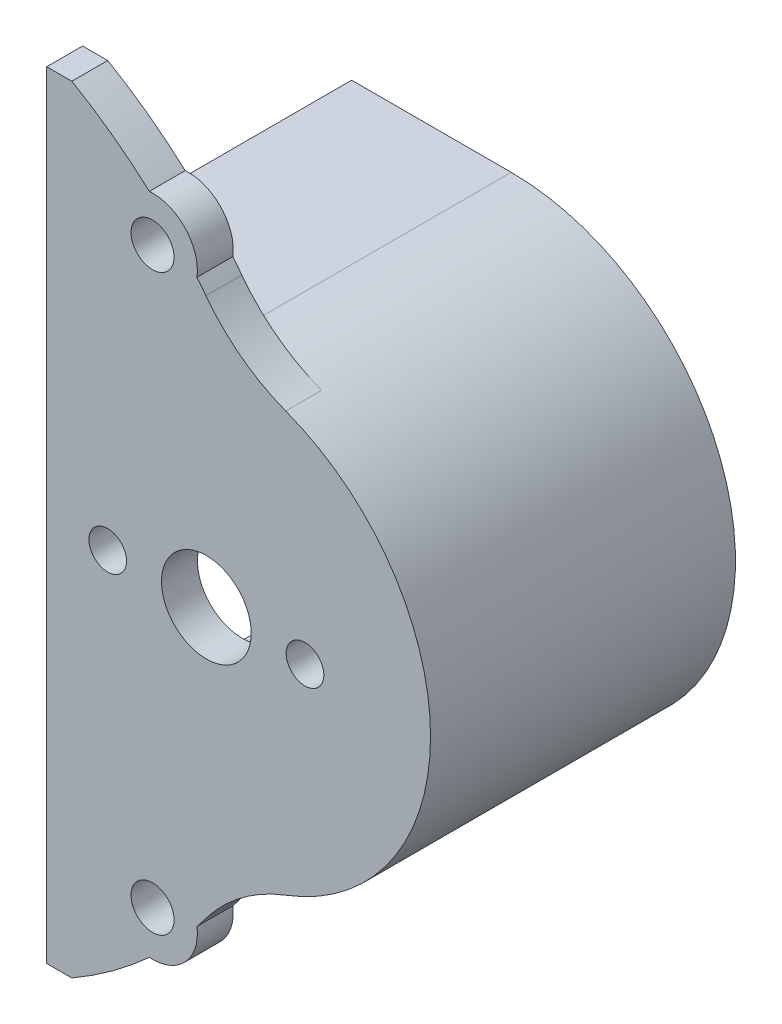
from build123d import *
from build123d.topology import SkipClean

# Parameters (mm, degrees)
EXTRUDE_1_DEPTH     = 2
SKETCH_2_R          = 2.5
SKETCH_2_R_2        = 1.05
CUT_EXTRUDE_1_DEPTH = 5
SKETCH_4_R          = 1.1
CUT_EXTRUDE_2_DEPTH = 2
EXTRUDE_START       = -2
EXTRUDE_2_DEPTH     = 2
SKETCH_6_OUTSIDE_W  = 57.136
SKETCH_6_OUTSIDE_H  = 39.994
SKETCH_6_OUTSIDE_R  = 12.5
CUT_EXTRUDE_3_DEPTH = 10
EXTRUDE_3_DEPTH     = 2
SKETCH_8_R          = 1.2
CUT_EXTRUDE_4_DEPTH = 10
SKETCH_9_OUTSIDE_W  = 38.188
SKETCH_9_OUTSIDE_H  = 63.188
CUT_EXTRUDE_5_DEPTH = 14
CUT_EXTRUDE_6_DEPTH = 10
SKETCH_11_W         = 2
SKETCH_11_H         = 43.30127019
EXTRUDE_4_DEPTH     = 1.4
EXTRUDE_1_2_DEPTH   = 15


with BuildPart() as part:
    # 草图1 → Extrude 1 (new body)
    with BuildSketch(Plane.XY):
        with BuildLine():
            ThreePointArc((21.650635095, 12.5), (0, 25), (-21.650635095, 12.5))
            ThreePointArc((-21.650635095, 12.5), (-19.820508076, 5.669872981), (-12.990381057, 7.5))
            ThreePointArc((-12.990381057, 7.5), (0, 15), (12.990381057, 7.5))
            ThreePointArc((12.990381057, 7.5), (19.820508076, 5.669872981), (21.650635095, 12.5))
        make_face()
    extrude(amount=EXTRUDE_1_DEPTH)

    # 草图2 → 切除-拉伸1 (cut)
    with BuildSketch(Plane.XY.offset(2)):
        with Locations((0, 20)):
            Circle(SKETCH_2_R)
        with Locations((-5.5, 20)):
            Circle(SKETCH_2_R_2)
        with Locations((5.5, 20)):
            Circle(SKETCH_2_R_2)
    extrude(amount=-CUT_EXTRUDE_1_DEPTH, mode=Mode.SUBTRACT)

    # 草图4 → 切除-拉伸2 (cut)
    with BuildSketch(Plane.XY.offset(2)):
        with Locations((-17.320508076, 10)):
            Circle(SKETCH_4_R)
        with Locations((17.320508076, 10)):
            Circle(SKETCH_4_R)
    extrude(amount=-CUT_EXTRUDE_2_DEPTH, mode=Mode.SUBTRACT)

    # 草图5 → 凸台-拉伸2 (add)
    with BuildSketch(Plane.XY.offset(2).offset(EXTRUDE_START)):
        with BuildLine():
            ThreePointArc((-9.363273917, 11.71875), (0, 7.5), (9.363273917, 11.71875))
            ThreePointArc((9.363273917, 11.71875), (0, 15), (-9.363273917, 11.71875))
        make_face()
        with BuildLine():
            ThreePointArc((12.381272085, 21.71875), (0, 25), (-12.381272085, 21.71875))
            ThreePointArc((-12.381272085, 21.71875), (0, 32.5), (12.381272085, 21.71875))
        make_face()
    extrude(amount=EXTRUDE_2_DEPTH)

    # 草图6 outside → 切除-拉伸3 (cut)
    with SkipClean():  # the faces are left unmerged after this step: merging them gives an invalid solid
        with BuildSketch(Plane.XY.offset(2)):
            with Locations((0, 18.75)):
                Rectangle(SKETCH_6_OUTSIDE_W, SKETCH_6_OUTSIDE_H)
            with Locations((0, 20)):
                Circle(SKETCH_6_OUTSIDE_R, mode=Mode.SUBTRACT)
        extrude(amount=-CUT_EXTRUDE_3_DEPTH, mode=Mode.SUBTRACT)

    # 草图7 → 凸台-拉伸3 (add)
    with SkipClean():  # the faces are left unmerged after this step: merging them gives an invalid solid
        with BuildSketch(Plane.XY.offset(2)):
            with BuildLine():
                Line((-7.5, 10), (-7.5, -5))
                Line((-7.5, -5), (7.5, -5))
                Line((7.5, -5), (7.5, 10))
                ThreePointArc((7.5, 10), (0, 7.5), (-7.5, 10))
            make_face()
            with BuildLine():
                Line((-7.5, 45), (7.5, 45))
                Line((7.5, 45), (7.5, 30))
                ThreePointArc((7.5, 30), (0, 32.5), (-7.5, 30))
                Line((-7.5, 30), (-7.5, 45))
            make_face()
        extrude(amount=-EXTRUDE_3_DEPTH)

    # 草图8 → 切除-拉伸4 (cut)
    with SkipClean():  # the faces are left unmerged after this step: merging them gives an invalid solid
        with BuildSketch(Plane.XY.offset(2)):
            with Locations((-3, 4)):
                Circle(SKETCH_8_R)
            with Locations((-3, 36)):
                Circle(SKETCH_8_R)
        extrude(amount=-CUT_EXTRUDE_4_DEPTH, mode=Mode.SUBTRACT)

    # 草图9 outside → 切除-拉伸5 (cut)
    with SkipClean():  # the faces are left unmerged after this step: merging them gives an invalid solid
        with BuildSketch(Plane.XY.offset(2)):
            with Locations((0, 20)):
                Rectangle(SKETCH_9_OUTSIDE_W, SKETCH_9_OUTSIDE_H)
            with BuildLine():
                ThreePointArc((4.427083333, 8.310220996), (12.5, 20), (4.427083333, 31.689779004))
                ThreePointArc((4.427083333, 31.689779004), (1.965433704, 33.044090503), (-0.022321429, 35.029715862))
                ThreePointArc((-0.022321429, 35.029715862), (-0.269391354, 35.352624611), (-0.52168006, 35.671472564))
                ThreePointArc((-0.52168006, 35.671472564), (-1.179500018, 37.713411748), (-3.177861224, 38.493665051))
                ThreePointArc((-3.177861224, 38.493665051), (-45, 20), (-3.177861224, 1.506334949))
                ThreePointArc((-3.177861224, 1.506334949), (-1.179500018, 2.286588252), (-0.52168006, 4.328527436))
                ThreePointArc((-0.52168006, 4.328527436), (-0.269391354, 4.647375389), (-0.022321429, 4.970284138))
                ThreePointArc((-0.022321429, 4.970284138), (1.965433704, 6.955909497), (4.427083333, 8.310220996))
            make_face(mode=Mode.SUBTRACT)
        extrude(amount=-CUT_EXTRUDE_5_DEPTH, mode=Mode.SUBTRACT)

    # 草图10 → 切除-拉伸6 (cut)
    with SkipClean():  # the faces are left unmerged after this step: merging them gives an invalid solid
        with BuildSketch(Plane(origin=(0, 0, 0), x_dir=(-1, 0, 0), z_dir=(0, 0, -1))):
            Polygon((7.5, 35.825317547), (7.5, 4.174682453), (36.824100737, 12.604038964), align=None)
        extrude(amount=-CUT_EXTRUDE_6_DEPTH, mode=Mode.SUBTRACT)

    # 草图11 → 凸台-拉伸4 (add)
    with SkipClean():  # the faces are left unmerged after this step: merging them gives an invalid solid
        with BuildSketch(Plane.ZY.offset(7.5)):
            with Locations((1, 20)):
                Rectangle(SKETCH_11_W, SKETCH_11_H)
        extrude(amount=EXTRUDE_4_DEPTH)

    # 草图12 → Extrude 1 2 (add)
    with SkipClean():  # the faces are left unmerged after this step: merging them gives an invalid solid
        with BuildSketch(Plane(origin=(0, 0, 0), x_dir=(-1, 0, 0), z_dir=(0, 0, -1))):
            with BuildLine():
                Line((8.9, 7.5), (0, 7.5))
                ThreePointArc((0, 7.5), (-12.5, 20), (0, 32.5))
                Line((0, 32.5), (8.9, 32.5))
                Line((8.9, 32.5), (8.9, 31.5))
                Line((8.9, 31.5), (0, 31.5))
                ThreePointArc((0, 31.5), (-11.5, 20), (0, 8.5))
                Line((0, 8.5), (8.9, 8.5))
                Line((8.9, 8.5), (8.9, 7.5))
            make_face()
        extrude(amount=EXTRUDE_1_2_DEPTH)


solid = part.part
